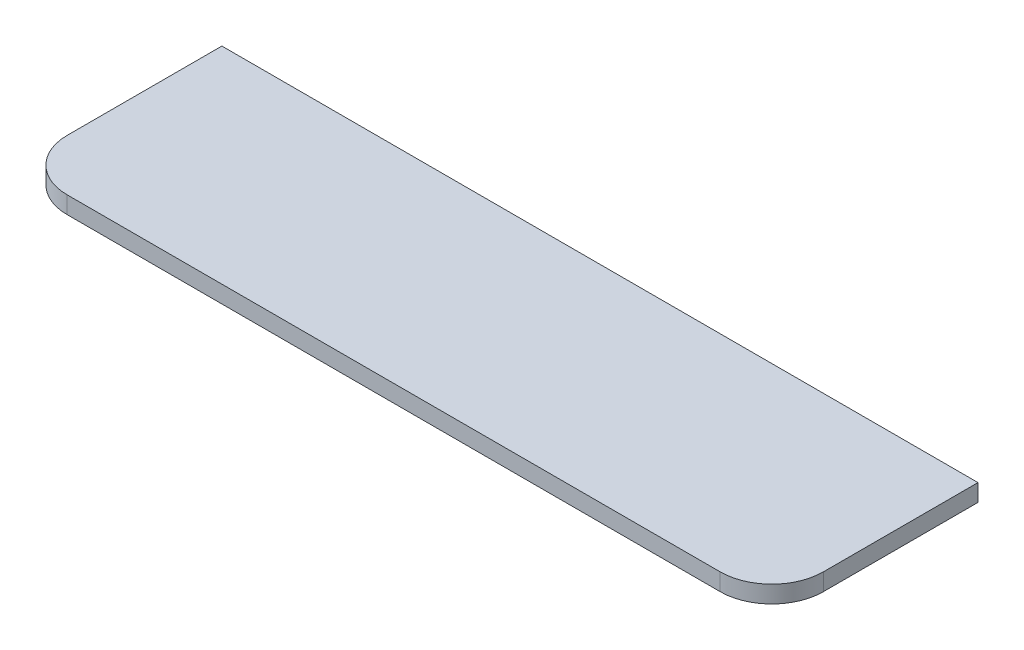
from build123d import *

# Parameters (mm, degrees)
BOSS_EXTRUDE1_DEPTH = 10


with BuildPart() as part:
    # Sketch1 → Boss-Extrude1 (new body)
    with BuildSketch(Plane(origin=(0, 0, 0), x_dir=(1, 0, 0), z_dir=(0, 1, 0))):
        with BuildLine():
            Line((-190, -60), (190, -60))
            ThreePointArc((190, -60), (211.213203436, -51.213203436), (220, -30))
            Line((220, -30), (220, 60))
            Line((220, 60), (-220, 60))
            Line((-220, 60), (-220, -30))
            ThreePointArc((-220, -30), (-211.213203436, -51.213203436), (-190, -60))
        make_face()
    extrude(amount=BOSS_EXTRUDE1_DEPTH)


solid = part.part
